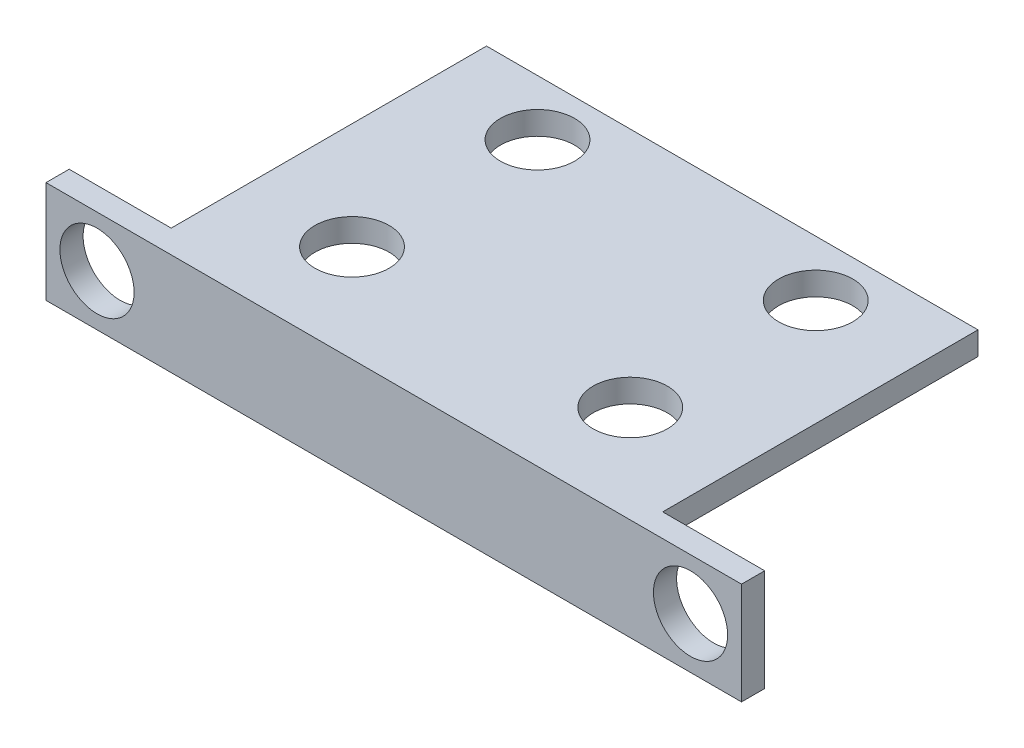
from build123d import *

# Parameters (mm, degrees)
SKETCH_1_W      = 53
SKETCH_1_H      = 36.5
SKETCH_1_R      = 4
EXTRUDE_1_DEPTH = 2.5
SKETCH_2_W      = 75
SKETCH_2_H      = 11
SKETCH_2_R      = 4
EXTRUDE_2_DEPTH = 2.5


with BuildPart() as part:
    # 草图1 → 凸台-拉伸1 (new body)
    with BuildSketch(Plane(origin=(0, 0, 0), x_dir=(1, 0, 0), z_dir=(0, 1, 0))):
        with Locations((13.886189258, -1.177109974)):
            Rectangle(SKETCH_1_W, SKETCH_1_H)
        with Locations(Location((-1.113810742, 11.072890026, 0), (0, 0, 270))):
            Circle(SKETCH_1_R, mode=Mode.SUBTRACT)
        with Locations(Location((28.886189258, 11.072890026, 0), (0, 0, 270))):
            Circle(SKETCH_1_R, mode=Mode.SUBTRACT)
        with Locations(Location((28.886189258, -8.927109974, 0), (0, 0, 270))):
            Circle(SKETCH_1_R, mode=Mode.SUBTRACT)
        with Locations(Location((-1.113810742, -8.927109974, 0), (0, 0, 270))):
            Circle(SKETCH_1_R, mode=Mode.SUBTRACT)
    extrude(amount=EXTRUDE_1_DEPTH)

    # 草图2 → 凸台-拉伸2 (add)
    with BuildSketch(Plane.XY.offset(19.427109974)):
        with Locations((13.886189258, -3)):
            Rectangle(SKETCH_2_W, SKETCH_2_H)
        with Locations((-18.113810742, -3)):
            Circle(SKETCH_2_R, mode=Mode.SUBTRACT)
        with Locations((45.886189258, -3)):
            Circle(SKETCH_2_R, mode=Mode.SUBTRACT)
    extrude(amount=-EXTRUDE_2_DEPTH)


solid = part.part
